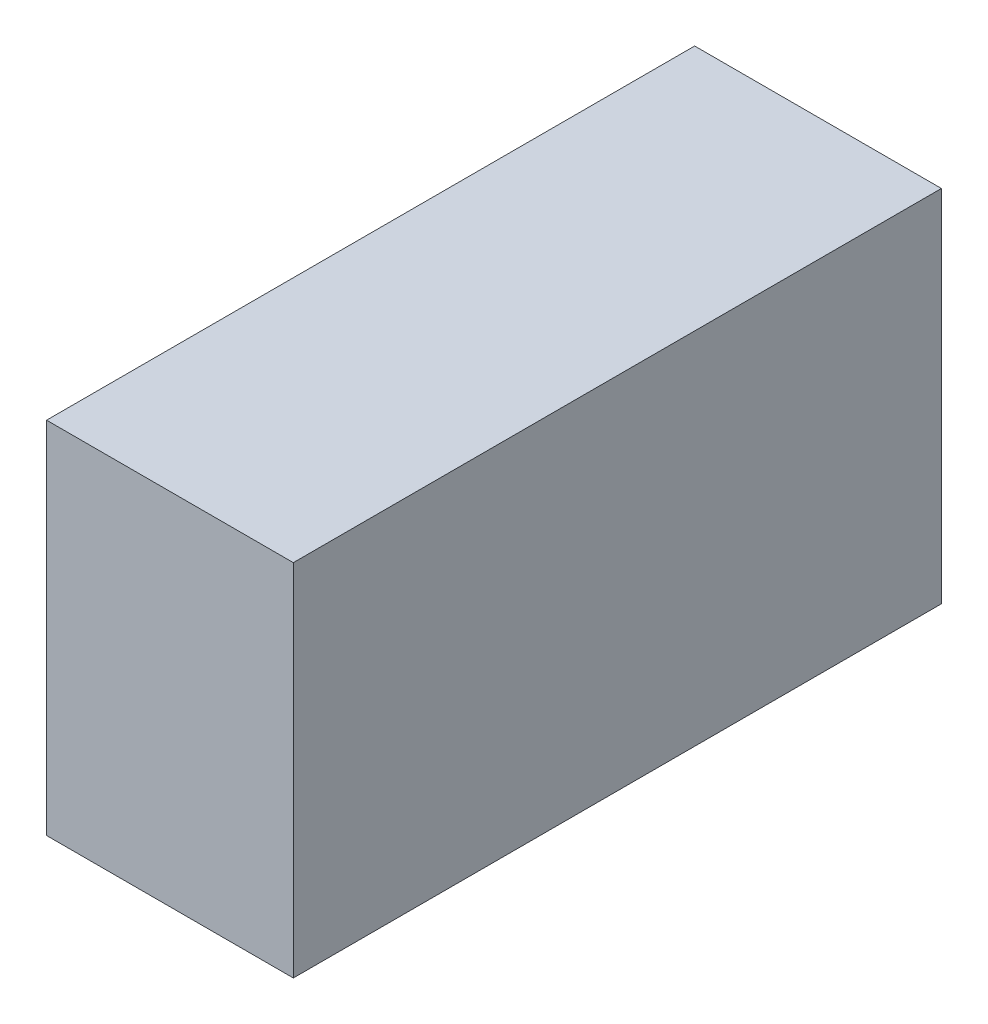
from build123d import *

# Parameters (mm, degrees)
SKETCH1_W           = 83
SKETCH1_H           = 121
BOSS_EXTRUDE1_DEPTH = 218


with BuildPart() as part:
    # Sketch1 → Boss-Extrude1 (new body)
    with BuildSketch(Plane.XY):
        with Locations((4.988701037, -16.510691492)):
            Rectangle(SKETCH1_W, SKETCH1_H)
    extrude(amount=BOSS_EXTRUDE1_DEPTH)


solid = part.part
